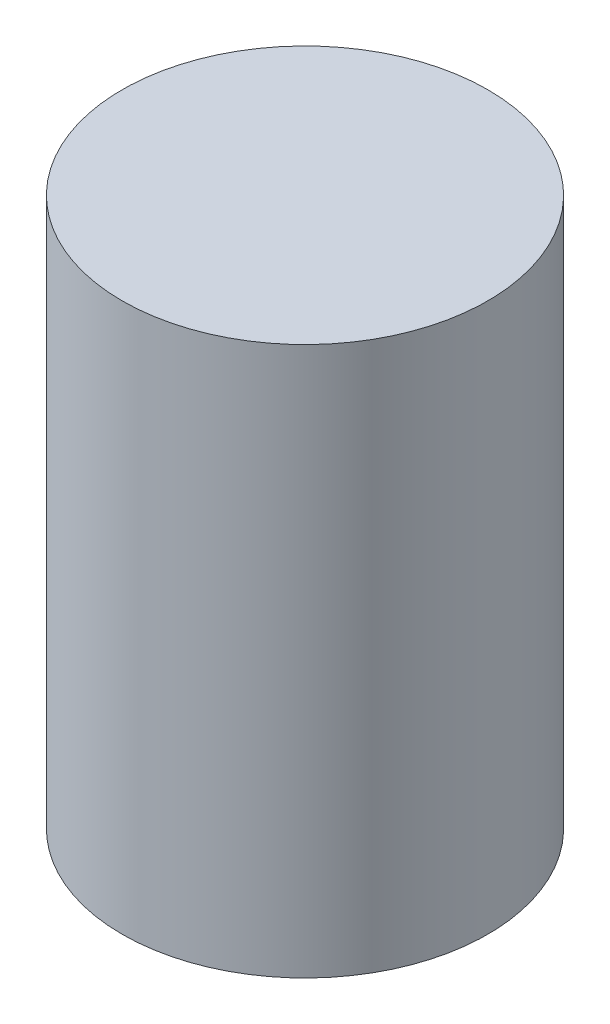
from build123d import *

# Parameters (mm, degrees)
SKETCH1_R           = 60
BOSS_EXTRUDE1_DEPTH = 180


with BuildPart() as part:
    # Sketch1 → Boss-Extrude1 (new body)
    with BuildSketch(Plane(origin=(0, 0, 0), x_dir=(1, 0, 0), z_dir=(0, 1, 0))):
        with Locations((-17.418759742, 18.598516378)):
            Circle(SKETCH1_R)
    extrude(amount=BOSS_EXTRUDE1_DEPTH)


solid = part.part
